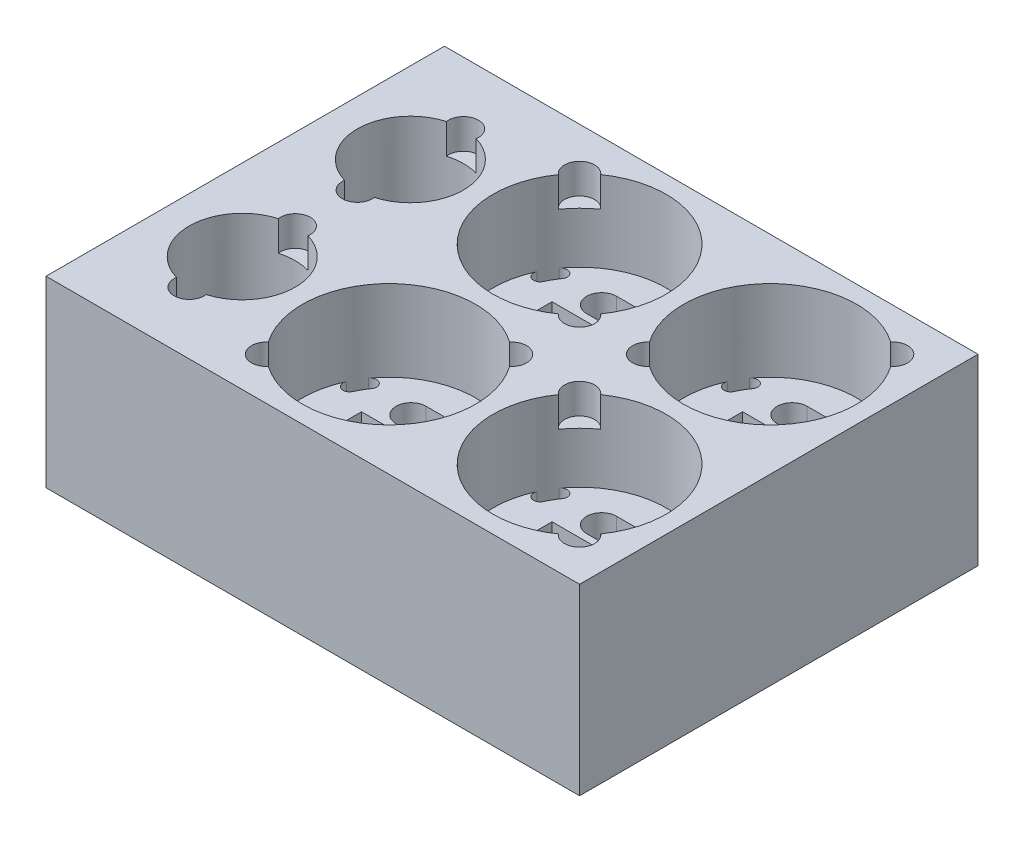
from build123d import *

# Parameters (mm, degrees)
SKETCH_1_W              = 533
SKETCH_1_H              = 398
EXTRUDE_286_DEPTH       = 183
SKETCH_2_R              = 86.5
CUT_EXTRUDE_597_DEPTH   = 81
SKETCH_3_R              = 53
CUT_EXTRUDE_101_DEPTH   = 150
SKETCH_4_R              = 15
CUT_EXTRUDE_1795_DEPTH  = 30
SKETCH_5_W              = 90
SKETCH_5_H              = 35
CUT_EXTRUDE_2164_DEPTH  = 30
CUT_EXTRUDE_597_2_DEPTH = 30


with BuildPart() as part:
    # Эскиз1 → Extrude 286 (new body)
    with BuildSketch(Plane(origin=(0, 0, 0), x_dir=(1, 0, 0), z_dir=(0, 1, 0))):
        with Locations((266.5, 199)):
            Rectangle(SKETCH_1_W, SKETCH_1_H)
    extrude(amount=-EXTRUDE_286_DEPTH)

    # Эскиз2 → Cut-Extrude 597 (cut)
    with BuildSketch(Plane(origin=(0, 0, 0), x_dir=(1, 0, 0), z_dir=(0, 1, 0))):
        with Locations(Location((429.166666667, 103.833333333, 0), (0, 0, 270))):
            Circle(SKETCH_2_R)
        with Locations(Location((238.833333333, 103.833333333, 0), (0, 0, 270))):
            Circle(SKETCH_2_R)
        with Locations(Location((238.833333333, 294.166666667, 0), (0, 0, 270))):
            Circle(SKETCH_2_R)
        with Locations(Location((429.166666667, 294.166666667, 0), (0, 0, 270))):
            Circle(SKETCH_2_R)
    extrude(amount=-CUT_EXTRUDE_597_DEPTH, mode=Mode.SUBTRACT)

    # Эскиз3 → КМЕ-101 (cut)
    with BuildSketch(Plane(origin=(0, 0, 0), x_dir=(1, 0, 0), z_dir=(0, 1, 0))):
        with Locations(Location((81, 283, 0), (0, 0, 270))):
            Circle(SKETCH_3_R)
        with Locations(Location((81, 115, 0), (0, 0, 270))):
            Circle(SKETCH_3_R)
    extrude(amount=-CUT_EXTRUDE_101_DEPTH, mode=Mode.SUBTRACT)

    # Эскиз4 → Cut-Extrude 1795 (cut)
    with BuildSketch(Plane(origin=(0, 0, 0), x_dir=(1, 0, 0), z_dir=(0, 1, 0))):
        with Locations((81, 336)):
            Circle(SKETCH_4_R)
        with Locations((81, 230)):
            Circle(SKETCH_4_R)
        with Locations((81, 168)):
            Circle(SKETCH_4_R)
        with Locations((81, 62)):
            Circle(SKETCH_4_R)
        with Locations((299.998069906, 233.001930094)):
            Circle(SKETCH_4_R)
        with Locations((177.668596761, 355.331403239)):
            Circle(SKETCH_4_R)
        with Locations((368.001930094, 233.001930094)):
            Circle(SKETCH_4_R)
        with Locations((490.331403239, 355.331403239)):
            Circle(SKETCH_4_R)
        with Locations((368.001930094, 164.998069906)):
            Circle(SKETCH_4_R)
        with Locations((490.331403239, 42.668596761)):
            Circle(SKETCH_4_R)
        with Locations((299.998069906, 164.998069906)):
            Circle(SKETCH_4_R)
        with Locations((177.668596761, 42.668596761)):
            Circle(SKETCH_4_R)
    extrude(amount=-CUT_EXTRUDE_1795_DEPTH, mode=Mode.SUBTRACT)

    # Эскиз5 → Cut-Extrude 2164 (cut)
    with BuildSketch(Plane(origin=(0, -81, 0), x_dir=(1, 0, 0), z_dir=(0, 1, 0))):
        with Locations((429.166666667, 294.166666667)):
            Rectangle(SKETCH_5_W, SKETCH_5_H)
        with Locations((238.833333333, 294.166666667)):
            Rectangle(SKETCH_5_W, SKETCH_5_H)
        with Locations((429.166666667, 103.833333333)):
            Rectangle(SKETCH_5_W, SKETCH_5_H)
        with Locations((238.833333333, 103.833333333)):
            Rectangle(SKETCH_5_W, SKETCH_5_H)
    extrude(amount=-CUT_EXTRUDE_2164_DEPTH, mode=Mode.SUBTRACT)

    # Эскиз6 → Cut-Extrude 597 2 (cut)
    with BuildSketch(Plane(origin=(0, -81, 0), x_dir=(1, 0, 0), z_dir=(0, 1, 0))):
        with BuildLine():
            Line((221.333333333, 348.666666667), (256.333333333, 348.666666667))
            ThreePointArc((256.333333333, 348.666666667), (271.333333333, 333.666666667), (256.333333333, 318.666666667))
            Line((256.333333333, 318.666666667), (221.333333333, 318.666666667))
            ThreePointArc((221.333333333, 318.666666667), (206.333333333, 333.666666667), (221.333333333, 348.666666667))
        make_face()
        with BuildLine():
            Line((411.666666667, 348.666666667), (446.666666667, 348.666666667))
            ThreePointArc((446.666666667, 348.666666667), (461.666666667, 333.666666667), (446.666666667, 318.666666667))
            Line((446.666666667, 318.666666667), (411.666666667, 318.666666667))
            ThreePointArc((411.666666667, 318.666666667), (396.666666667, 333.666666667), (411.666666667, 348.666666667))
        make_face()
        with BuildLine():
            Line((411.666666667, 158.333333333), (446.666666667, 158.333333333))
            ThreePointArc((446.666666667, 158.333333333), (461.666666667, 143.333333333), (446.666666667, 128.333333333))
            Line((446.666666667, 128.333333333), (411.666666667, 128.333333333))
            ThreePointArc((411.666666667, 128.333333333), (396.666666667, 143.333333333), (411.666666667, 158.333333333))
        make_face()
        with BuildLine():
            Line((221.333333333, 158.333333333), (256.333333333, 158.333333333))
            ThreePointArc((256.333333333, 158.333333333), (271.333333333, 143.333333333), (256.333333333, 128.333333333))
            Line((256.333333333, 128.333333333), (221.333333333, 128.333333333))
            ThreePointArc((221.333333333, 128.333333333), (206.333333333, 143.333333333), (221.333333333, 158.333333333))
        make_face()
        with BuildLine():
            ThreePointArc((317.469292127, 330.203258966), (313.744530761, 337.416666667), (309.359917127, 344.249108484))
            ThreePointArc((309.359917127, 344.249108484), (300.296811157, 345.785373488), (298.760546153, 336.722267517))
            ThreePointArc((298.760546153, 336.722267517), (302.486200511, 330.916666667), (305.651171153, 324.787354921))
            ThreePointArc((305.651171153, 324.787354921), (314.268183662, 321.586246456), (317.469292127, 330.203258966))
        make_face()
        with BuildLine():
            ThreePointArc((168.306749539, 344.249108484), (163.922135906, 337.416666667), (160.197374539, 330.203258966))
            ThreePointArc((160.197374539, 330.203258966), (163.398483004, 321.586246456), (172.015495514, 324.787354921))
            ThreePointArc((172.015495514, 324.787354921), (175.180466155, 330.916666667), (178.906120514, 336.722267517))
            ThreePointArc((178.906120514, 336.722267517), (177.36985551, 345.785373488), (168.306749539, 344.249108484))
        make_face()
        with BuildLine():
            ThreePointArc((230.723958333, 208.04763255), (238.833333333, 207.666666667), (246.942708333, 208.04763255))
            ThreePointArc((246.942708333, 208.04763255), (252.804705839, 215.128380056), (245.723958333, 220.990377562))
            ThreePointArc((245.723958333, 220.990377562), (238.833333333, 220.666666667), (231.942708333, 220.990377562))
            ThreePointArc((231.942708333, 220.990377562), (224.861960827, 215.128380056), (230.723958333, 208.04763255))
        make_face()
        with BuildLine():
            ThreePointArc((358.640082873, 344.249108484), (354.255469239, 337.416666667), (350.530707873, 330.203258966))
            ThreePointArc((350.530707873, 330.203258966), (353.731816338, 321.586246456), (362.348828847, 324.787354921))
            ThreePointArc((362.348828847, 324.787354921), (365.513799489, 330.916666667), (369.239453847, 336.722267517))
            ThreePointArc((369.239453847, 336.722267517), (367.703188843, 345.785373488), (358.640082873, 344.249108484))
        make_face()
        with BuildLine():
            ThreePointArc((507.802625461, 330.203258966), (504.077864094, 337.416666667), (499.693250461, 344.249108484))
            ThreePointArc((499.693250461, 344.249108484), (490.63014449, 345.785373488), (489.093879486, 336.722267517))
            ThreePointArc((489.093879486, 336.722267517), (492.819533845, 330.916666667), (495.984504486, 324.787354921))
            ThreePointArc((495.984504486, 324.787354921), (504.601516996, 321.586246456), (507.802625461, 330.203258966))
        make_face()
        with BuildLine():
            ThreePointArc((421.057291667, 208.04763255), (429.166666667, 207.666666667), (437.276041667, 208.04763255))
            ThreePointArc((437.276041667, 208.04763255), (443.138039173, 215.128380056), (436.057291667, 220.990377562))
            ThreePointArc((436.057291667, 220.990377562), (429.166666667, 220.666666667), (422.276041667, 220.990377562))
            ThreePointArc((422.276041667, 220.990377562), (415.195294161, 215.128380056), (421.057291667, 208.04763255))
        make_face()
        with BuildLine():
            ThreePointArc((358.640082873, 153.91577515), (354.255469239, 147.083333333), (350.530707873, 139.869925633))
            ThreePointArc((350.530707873, 139.869925633), (353.731816338, 131.252913123), (362.348828847, 134.454021588))
            ThreePointArc((362.348828847, 134.454021588), (365.513799489, 140.583333333), (369.239453847, 146.388934184))
            ThreePointArc((369.239453847, 146.388934184), (367.703188843, 155.452040154), (358.640082873, 153.91577515))
        make_face()
        with BuildLine():
            ThreePointArc((507.802625461, 139.869925633), (504.077864094, 147.083333333), (499.693250461, 153.91577515))
            ThreePointArc((499.693250461, 153.91577515), (490.63014449, 155.452040154), (489.093879486, 146.388934184))
            ThreePointArc((489.093879486, 146.388934184), (492.819533845, 140.583333333), (495.984504486, 134.454021588))
            ThreePointArc((495.984504486, 134.454021588), (504.601516996, 131.252913123), (507.802625461, 139.869925633))
        make_face()
        with BuildLine():
            ThreePointArc((421.057291667, 17.714299217), (429.166666667, 17.333333333), (437.276041667, 17.714299217))
            ThreePointArc((437.276041667, 17.714299217), (443.138039173, 24.795046723), (436.057291667, 30.657044229))
            ThreePointArc((436.057291667, 30.657044229), (429.166666667, 30.333333333), (422.276041667, 30.657044229))
            ThreePointArc((422.276041667, 30.657044229), (415.195294161, 24.795046723), (421.057291667, 17.714299217))
        make_face()
        with BuildLine():
            ThreePointArc((168.306749539, 153.91577515), (163.922135906, 147.083333333), (160.197374539, 139.869925633))
            ThreePointArc((160.197374539, 139.869925633), (163.398483004, 131.252913123), (172.015495514, 134.454021588))
            ThreePointArc((172.015495514, 134.454021588), (175.180466155, 140.583333333), (178.906120514, 146.388934184))
            ThreePointArc((178.906120514, 146.388934184), (177.36985551, 155.452040154), (168.306749539, 153.91577515))
        make_face()
        with BuildLine():
            ThreePointArc((317.469292127, 139.869925633), (313.744530761, 147.083333333), (309.359917127, 153.91577515))
            ThreePointArc((309.359917127, 153.91577515), (300.296811157, 155.452040154), (298.760546153, 146.388934184))
            ThreePointArc((298.760546153, 146.388934184), (302.486200511, 140.583333333), (305.651171153, 134.454021588))
            ThreePointArc((305.651171153, 134.454021588), (314.268183662, 131.252913123), (317.469292127, 139.869925633))
        make_face()
        with BuildLine():
            ThreePointArc((230.723958333, 17.714299217), (238.833333333, 17.333333333), (246.942708333, 17.714299217))
            ThreePointArc((246.942708333, 17.714299217), (252.804705839, 24.795046723), (245.723958333, 30.657044229))
            ThreePointArc((245.723958333, 30.657044229), (238.833333333, 30.333333333), (231.942708333, 30.657044229))
            ThreePointArc((231.942708333, 30.657044229), (224.861960827, 24.795046723), (230.723958333, 17.714299217))
        make_face()
    extrude(amount=-CUT_EXTRUDE_597_2_DEPTH, mode=Mode.SUBTRACT)


solid = part.part
